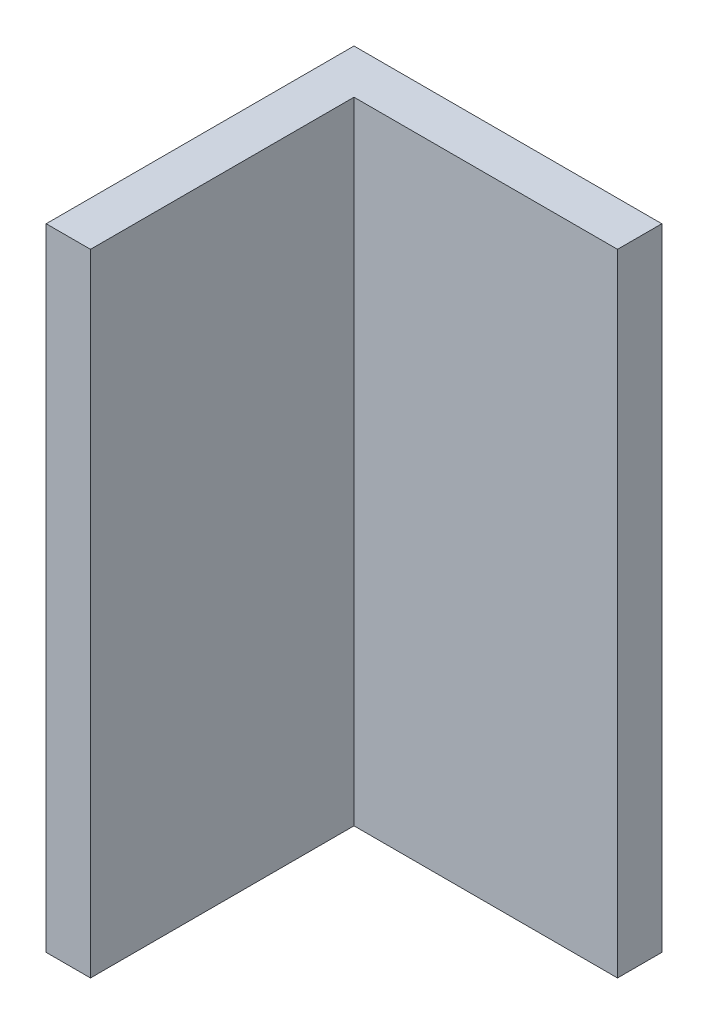
from build123d import *

# Parameters (mm, degrees)
SKETCH2_W           = 25.4
SKETCH2_H           = 25.4
BOSS_EXTRUDE1_DEPTH = 52.07
SKETCH3_W           = 21.7424
SKETCH3_H           = 21.7424
CUT_EXTRUDE1_DEPTH  = 52.07


with BuildPart() as part:
    # Sketch2 → Boss-Extrude1 (new body)
    with BuildSketch(Plane(origin=(0, 0, 0), x_dir=(1, 0, 0), z_dir=(0, 1, 0))):
        with Locations((12.7, -12.7)):
            Rectangle(SKETCH2_W, SKETCH2_H)
    extrude(amount=BOSS_EXTRUDE1_DEPTH)

    # Sketch3 → Cut-Extrude1 (cut)
    with BuildSketch(Plane(origin=(0, 52.07, 0), x_dir=(1, 0, 0), z_dir=(0, 1, 0))):
        with Locations((14.5288, -14.5288)):
            Rectangle(SKETCH3_W, SKETCH3_H)
    extrude(amount=-CUT_EXTRUDE1_DEPTH, mode=Mode.SUBTRACT)


solid = part.part
